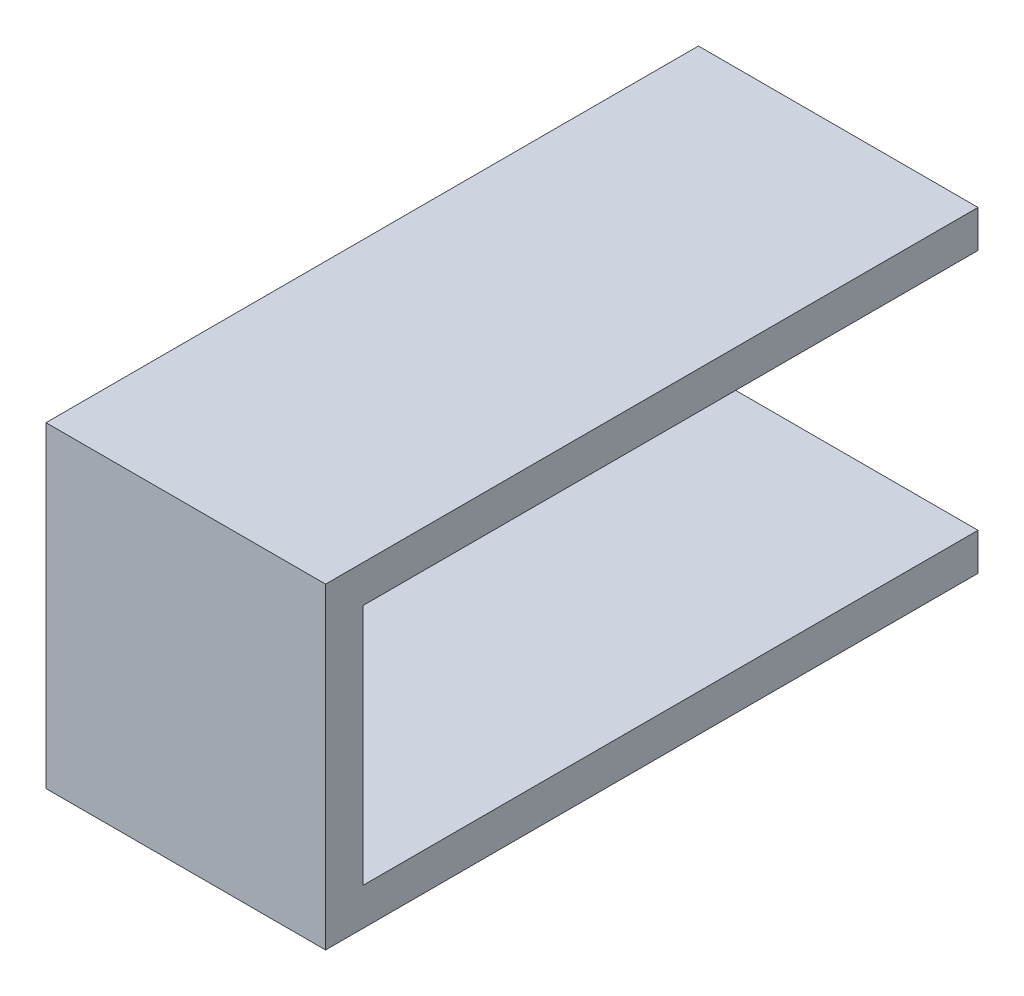
from build123d import *

# Parameters (mm, degrees)
BOSS_EXTRUDE1_DEPTH = 38.1


with BuildPart() as part:
    # Sketch1 → Boss-Extrude1 (new body)
    with BuildSketch(Plane.YZ):
        Polygon((-16.51, -41.91), (-16.51, 41.91), (16.51, 41.91), (16.51, -41.91), (21.59, -41.91), (21.59, 46.99), (-21.59, 46.99), (-21.59, -41.91), align=None)
    extrude(amount=BOSS_EXTRUDE1_DEPTH)


solid = part.part
